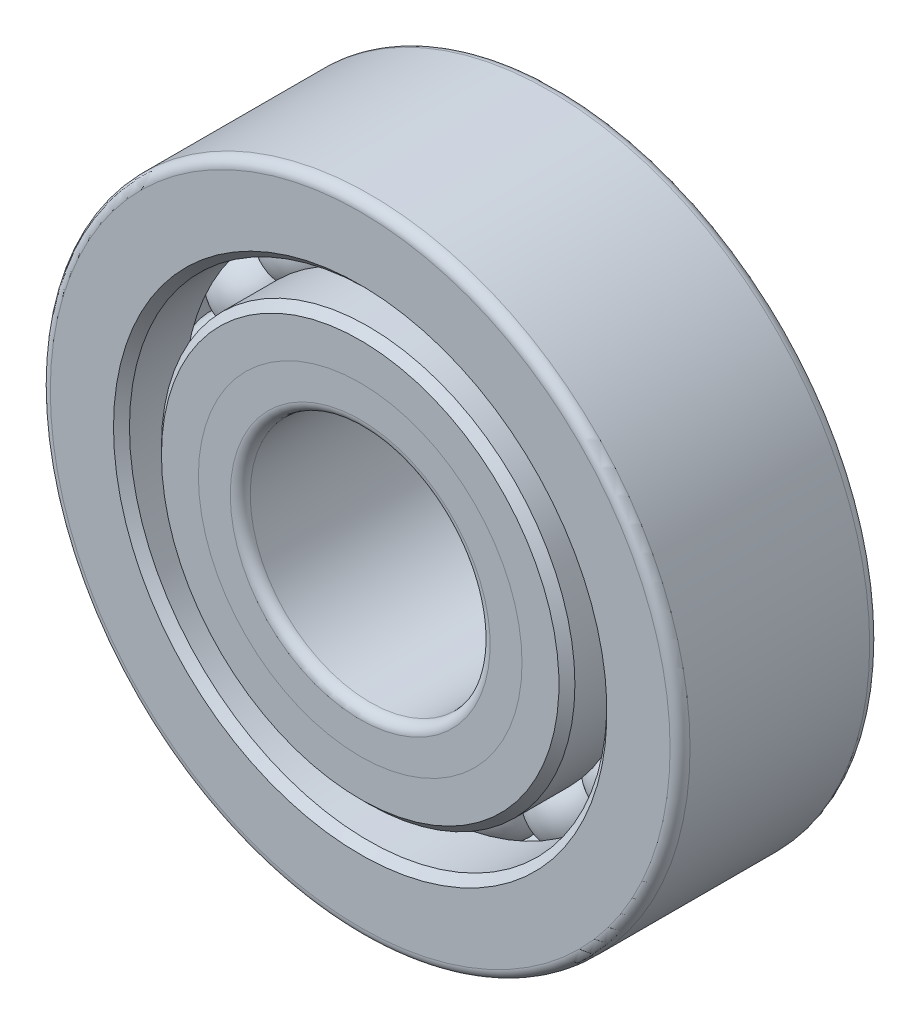
from build123d import *

# Parameters (mm, degrees)
SKETCH3_W              = 7.9248
SKETCH3_H              = 3.44551
SKETCH3_H_2            = 3.22199
SKETCH4_R              = 1.5875
CIRPATTERN1_COUNT      = 17
FILLET1_R              = 0.39624
FILLET2_R              = 0.39624
CHAMFER1_SIZE          = 0.316992
CHAMFER2_SIZE          = 0.316992
SPLIT1_SURFACE_1_BACK  = 37.785
SPLIT1_SURFACE_1_DEPTH = 75.57
SPLIT1_SURFACE_2_BACK  = 37.785
SPLIT1_SURFACE_2_DEPTH = 75.57


with BuildPart() as part:
    # Sketch3 → Revolve2 (revolve)
    with BuildSketch(Plane(origin=(0, 0, 0), x_dir=(0, 0, -1), z_dir=(1, 0, 0)), mode=Mode.PRIVATE) as revolve2_sk:
        with Locations((0, 6.485255)):
            Rectangle(SKETCH3_W, SKETCH3_H)
        with Locations((0, 11.089005)):
            Rectangle(SKETCH3_W, SKETCH3_H_2)
    revolve(revolve2_sk.sketch.rotate(Axis((0, 0, 3.9624), (0, 0, -1)), 90), axis=Axis((0, 0, 3.9624), (0, 0, -1)))

    # Sketch4 → Cut-Revolve1 (revolve, cut)
    with BuildSketch(Plane(origin=(0, 0, 0), x_dir=(0, 0, -1), z_dir=(1, 0, 0)), mode=Mode.PRIVATE) as cut_revolve1_sk:
        with Locations((0, 8.84301)):
            Circle(SKETCH4_R)
    revolve(cut_revolve1_sk.sketch.rotate(Axis((0, 0, 3.9624), (0, 0, -1)), 90), axis=Axis((0, 0, 3.9624), (0, 0, -1)), mode=Mode.SUBTRACT)

    # Fillet1
    fillet1_edges = [part.edges().sort_by_distance(p)[0] for p in [
        (-12.7, 0, -3.9624),
        (-12.7, 0, 3.9624),
    ]]
    fillet(fillet1_edges, radius=FILLET1_R)

    # Fillet2
    fillet2_edges = [part.edges().sort_by_distance(p)[0] for p in [
        (-4.7625, 0, 3.9624),
        (-4.7625, 0, -3.9624),
    ]]
    fillet(fillet2_edges, radius=FILLET2_R)

    # Chamfer1
    chamfer1_edges = [part.edges().sort_by_distance(p)[0] for p in [
        (-9.47801, 0, -3.9624),
        (-9.47801, 0, 3.9624),
    ]]
    chamfer(chamfer1_edges, length=CHAMFER1_SIZE)

    # Chamfer2
    chamfer2_edges = [part.edges().sort_by_distance(p)[0] for p in [
        (-8.20801, 0, 3.9624),
        (-8.20801, 0, -3.9624),
    ]]
    chamfer(chamfer2_edges, length=CHAMFER2_SIZE)


with BuildPart() as body_2:
    # Sketch5 → Revolve3 (revolve)
    with BuildSketch(Plane(origin=(0, 0, 0), x_dir=(0, 0, -1), z_dir=(1, 0, 0))):
        with BuildLine():
            Line((-1.5875, 8.84301), (1.5875, 8.84301))
            ThreePointArc((1.5875, 8.84301), (0, 10.43051), (-1.5875, 8.84301))
        make_face()
    revolve(axis=Axis((0, 8.84301, 1.5875), (0, 0, -1)))


with BuildPart() as cirpattern1_1:
    # CirPattern1: pattern copy
    add(body_2.part.rotate(Axis((0, 0, 0), (0, 0, 1)), 1 * 360 / CIRPATTERN1_COUNT))


with BuildPart() as cirpattern1_2:
    # CirPattern1: pattern copy
    add(body_2.part.rotate(Axis((0, 0, 0), (0, 0, 1)), 2 * 360 / CIRPATTERN1_COUNT))


with BuildPart() as cirpattern1_3:
    # CirPattern1: pattern copy
    add(body_2.part.rotate(Axis((0, 0, 0), (0, 0, 1)), 3 * 360 / CIRPATTERN1_COUNT))


with BuildPart() as cirpattern1_4:
    # CirPattern1: pattern copy
    add(body_2.part.rotate(Axis((0, 0, 0), (0, 0, 1)), 4 * 360 / CIRPATTERN1_COUNT))


with BuildPart() as cirpattern1_5:
    # CirPattern1: pattern copy
    add(body_2.part.rotate(Axis((0, 0, 0), (0, 0, 1)), 5 * 360 / CIRPATTERN1_COUNT))


with BuildPart() as cirpattern1_6:
    # CirPattern1: pattern copy
    add(body_2.part.rotate(Axis((0, 0, 0), (0, 0, 1)), 6 * 360 / CIRPATTERN1_COUNT))


with BuildPart() as cirpattern1_7:
    # CirPattern1: pattern copy
    add(body_2.part.rotate(Axis((0, 0, 0), (0, 0, 1)), 7 * 360 / CIRPATTERN1_COUNT))


with BuildPart() as cirpattern1_8:
    # CirPattern1: pattern copy
    add(body_2.part.rotate(Axis((0, 0, 0), (0, 0, 1)), 8 * 360 / CIRPATTERN1_COUNT))


with BuildPart() as cirpattern1_9:
    # CirPattern1: pattern copy
    add(body_2.part.rotate(Axis((0, 0, 0), (0, 0, 1)), 9 * 360 / CIRPATTERN1_COUNT))


with BuildPart() as cirpattern1_10:
    # CirPattern1: pattern copy
    add(body_2.part.rotate(Axis((0, 0, 0), (0, 0, 1)), 10 * 360 / CIRPATTERN1_COUNT))


with BuildPart() as cirpattern1_11:
    # CirPattern1: pattern copy
    add(body_2.part.rotate(Axis((0, 0, 0), (0, 0, 1)), 11 * 360 / CIRPATTERN1_COUNT))


with BuildPart() as cirpattern1_12:
    # CirPattern1: pattern copy
    add(body_2.part.rotate(Axis((0, 0, 0), (0, 0, 1)), 12 * 360 / CIRPATTERN1_COUNT))


with BuildPart() as cirpattern1_13:
    # CirPattern1: pattern copy
    add(body_2.part.rotate(Axis((0, 0, 0), (0, 0, 1)), 13 * 360 / CIRPATTERN1_COUNT))


with BuildPart() as cirpattern1_14:
    # CirPattern1: pattern copy
    add(body_2.part.rotate(Axis((0, 0, 0), (0, 0, 1)), 14 * 360 / CIRPATTERN1_COUNT))


with BuildPart() as cirpattern1_15:
    # CirPattern1: pattern copy
    add(body_2.part.rotate(Axis((0, 0, 0), (0, 0, 1)), 15 * 360 / CIRPATTERN1_COUNT))


with BuildPart() as cirpattern1_16:
    # CirPattern1: pattern copy
    add(body_2.part.rotate(Axis((0, 0, 0), (0, 0, 1)), 16 * 360 / CIRPATTERN1_COUNT))


with BuildPart() as body_19:
    # Split1: the piece behind the surface
    add(part.part)
    # Split1 surface: a surface, the sketch's curves swept straight by 75.57 mm
    with BuildLine(Plane.XY.offset(-SPLIT1_SURFACE_1_BACK), mode=Mode.PRIVATE) as split1_surface_1_path:
        CenterArc((0, 0), 6.424506667, 0, 360)
    split1_surface_1 = Shell.extrude(split1_surface_1_path.wire(), (0 * SPLIT1_SURFACE_1_DEPTH, 0 * SPLIT1_SURFACE_1_DEPTH, 1 * SPLIT1_SURFACE_1_DEPTH))
    split(bisect_by=split1_surface_1, keep=Keep.BOTTOM)


with BuildPart() as part_1:
    add(part.part)

    # Split1: split by a surface, the side it looks to stays
    # Split1 surface: a surface, the sketch's curves swept straight by 75.57 mm
    with BuildLine(Plane.XY.offset(-SPLIT1_SURFACE_2_BACK), mode=Mode.PRIVATE) as split1_surface_2_path:
        CenterArc((0, 0), 6.424506667, 0, 360)
    split1_surface_2 = Shell.extrude(split1_surface_2_path.wire(), (0 * SPLIT1_SURFACE_2_DEPTH, 0 * SPLIT1_SURFACE_2_DEPTH, 1 * SPLIT1_SURFACE_2_DEPTH))
    split(bisect_by=split1_surface_2, keep=Keep.TOP)


solid = Compound([body_2.part, cirpattern1_1.part, cirpattern1_2.part, cirpattern1_3.part, cirpattern1_4.part, cirpattern1_5.part, cirpattern1_6.part, cirpattern1_7.part, cirpattern1_8.part, cirpattern1_9.part, cirpattern1_10.part, cirpattern1_11.part, cirpattern1_12.part, cirpattern1_13.part, cirpattern1_14.part, cirpattern1_15.part, cirpattern1_16.part, body_19.part, part_1.part])
